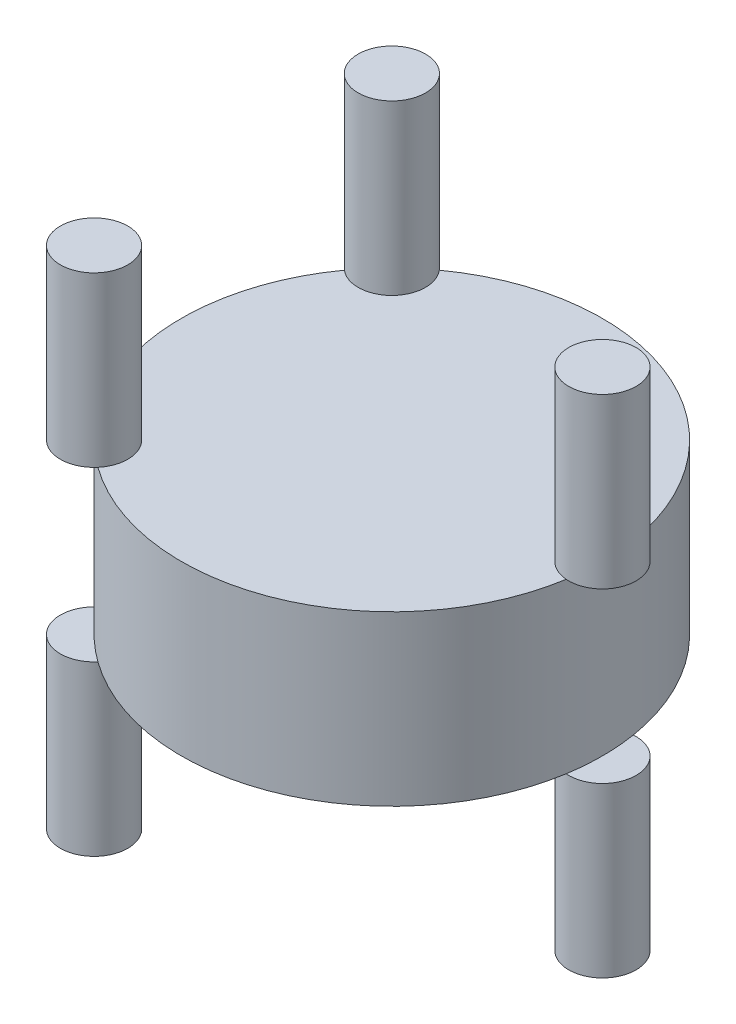
from build123d import *

# Parameters (mm, degrees)
SKETCH7_R           = 12.5
BOSS_EXTRUDE2_DEPTH = 10
SKETCH8_R           = 2
BOSS_EXTRUDE3_DEPTH = 10
SKETCH9_R           = 2
BOSS_EXTRUDE4_DEPTH = 10
BOSS_EXTRUDE5_START = 10
SKETCH12_R          = 2
BOSS_EXTRUDE5_DEPTH = 10
BOSS_EXTRUDE6_START = 10
SKETCH13_R          = 2
BOSS_EXTRUDE6_DEPTH = 10


with BuildPart() as part:
    # Sketch7 → Boss-Extrude2 (new body)
    with BuildSketch(Plane(origin=(0, 0, 0), x_dir=(1, 0, 0), z_dir=(0, 1, 0))):
        with Locations(Location((0, 0, 0), (0, 0, 270))):
            Circle(SKETCH7_R)
    extrude(amount=BOSS_EXTRUDE2_DEPTH)

    # Sketch8 → Boss-Extrude3 (add)
    with BuildSketch(Plane(origin=(0, 10, 0), x_dir=(1, 0, 0), z_dir=(0, 1, 0))):
        with Locations(Location((-8.838834765, 8.838834765, 0), (0, 0, 40.411434264))):
            Circle(SKETCH8_R)
    boss_extrude3 = extrude(amount=BOSS_EXTRUDE3_DEPTH)

    # Mirror1: Boss-Extrude3 across plane
    add(boss_extrude3.mirror(Plane.XY))

    # Sketch9 → Boss-Extrude4 (add)
    with BuildSketch(Plane(origin=(0, 10, 0), x_dir=(1, 0, 0), z_dir=(0, 1, 0))):
        with Locations(Location((12.5, 0, 0), (0, 0, 94.588565736))):
            Circle(SKETCH9_R)
    extrude(amount=BOSS_EXTRUDE4_DEPTH)

    # Sketch12 → Boss-Extrude5 (add)
    with BuildSketch(Plane.XZ.offset(BOSS_EXTRUDE5_START)):
        with Locations(Location((-8.838834765, -8.838834765, 0), (0, 0, 319.588565736))):
            Circle(SKETCH12_R)
    boss_extrude5 = extrude(amount=-BOSS_EXTRUDE5_DEPTH)

    # Mirror3: Boss-Extrude5 across plane
    add(boss_extrude5.mirror(Plane.XY))

    # Sketch13 → Boss-Extrude6 (add)
    with BuildSketch(Plane(origin=(0, 0, 0), x_dir=(-1, 0, 0), z_dir=(0, -1, 0)).offset(BOSS_EXTRUDE6_START)):
        with Locations(Location((-12.5, 0, 0), (0, 0, 85.411434264))):
            Circle(SKETCH13_R)
    extrude(amount=-BOSS_EXTRUDE6_DEPTH)


solid = part.part
